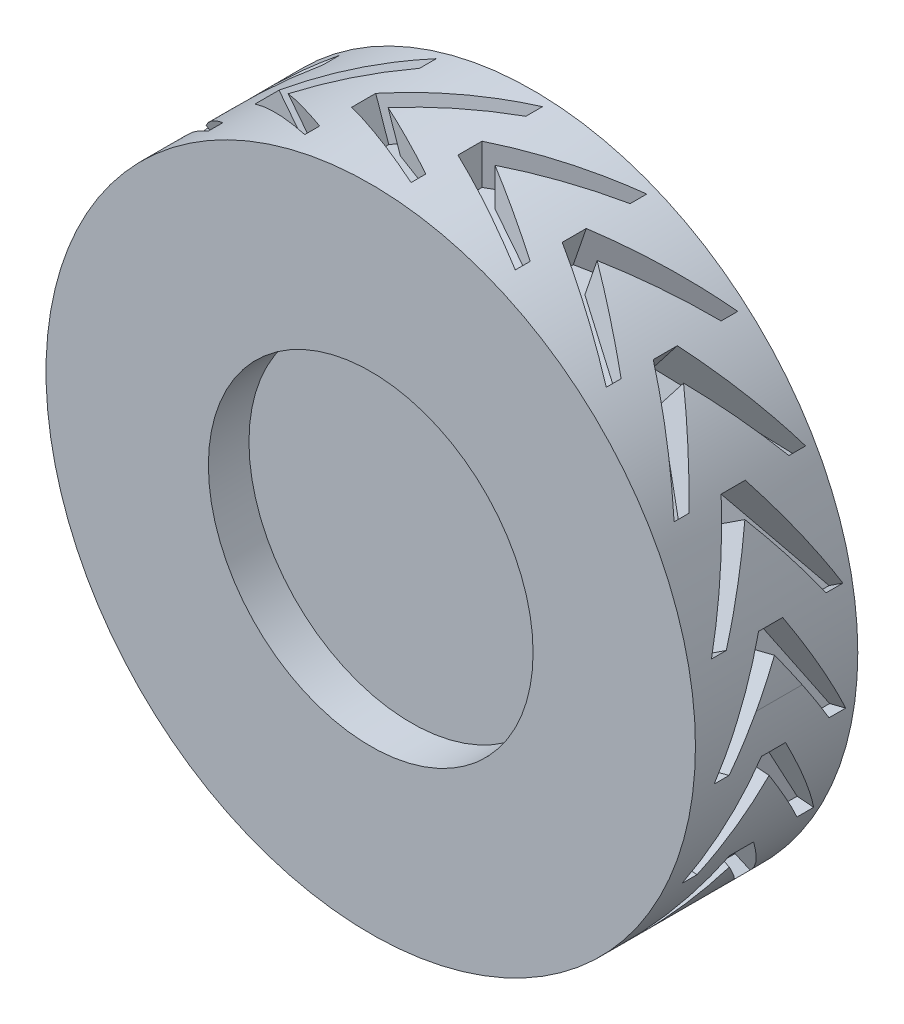
from build123d import *

# Parameters (mm, degrees)
SKETCH1_R           = 40
BOSS_EXTRUDE1_DEPTH = 10
SKETCH2_R           = 20
CUT_EXTRUDE1_DEPTH  = 5
CUT_EXTRUDE2_DEPTH  = 5
CIRPATTERN1_COUNT   = 19


with BuildPart() as part:
    # Sketch1 → Boss-Extrude1 (new, symmetric)
    with BuildSketch(Plane.XY):
        Circle(SKETCH1_R)
    extrude(amount=BOSS_EXTRUDE1_DEPTH, both=True)

    # Sketch2 → Cut-Extrude1 (cut)
    with BuildSketch(Plane.XY.offset(10)):
        Circle(SKETCH2_R)
    extrude(amount=-CUT_EXTRUDE1_DEPTH, mode=Mode.SUBTRACT)

    # Sketch3 → Cut-Extrude2 (cut)
    with BuildSketch(Plane(origin=(0, 40, 0), x_dir=(1, 0, 0), z_dir=(0, 1, 0))):
        Polygon((15.111025253, 8.895546941), (15.111025253, 6.842728416), (5.303114523, 0), (15.111025253, -5.474182733), (15.111025253, -7.298910311), (2.223886735, -1.482591157), (2.223886735, 1.482591157), align=None)
    cut_extrude2 = extrude(amount=-CUT_EXTRUDE2_DEPTH, mode=Mode.SUBTRACT)

    # CirPattern1: Cut-Extrude2 ×19 about axis
    cirpattern1_axis = Axis((0, 0, 0), (0, 0, 1))
    for i in range(1, CIRPATTERN1_COUNT):
        add(cut_extrude2.rotate(cirpattern1_axis, i * 360 / CIRPATTERN1_COUNT), mode=Mode.SUBTRACT)


solid = part.part
